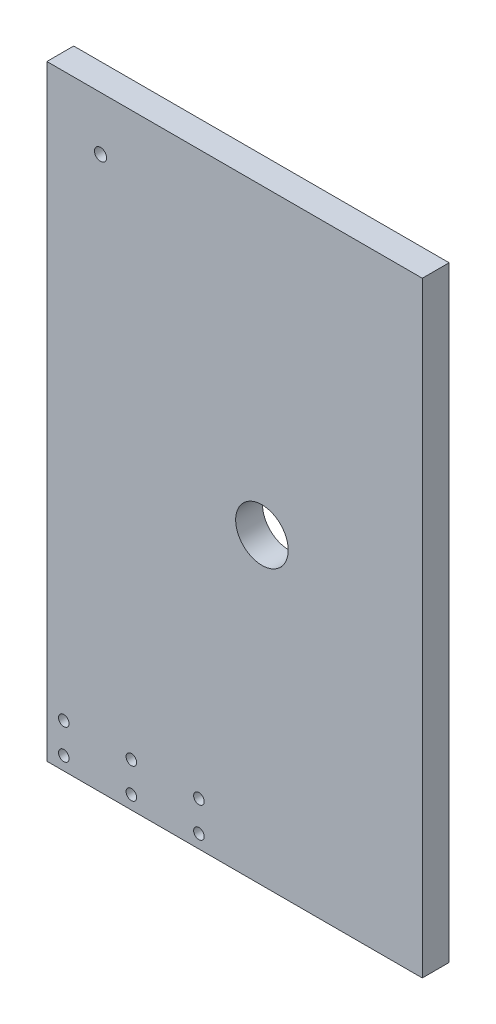
from build123d import *

# Parameters (mm, degrees)
SKETCH1_W           = 152.4
SKETCH1_H           = 143.51
SKETCH1_R           = 6.223
SKETCH1_R_2         = 1.4375
BOSS_EXTRUDE1_DEPTH = 6.35
SKETCH2_R           = 3.1115
CUT_EXTRUDE1_DEPTH  = 105.859632486
SKETCH4_R           = 1.625
CUT_EXTRUDE2_DEPTH  = 105.859632486
SKETCH5_W           = 63.5
SKETCH5_H           = 143.51
CUT_EXTRUDE3_DEPTH  = 105.859632486
SKETCH6_R           = 1.25
CUT_EXTRUDE4_DEPTH  = 105.859632486


with BuildPart() as part:
    # Sketch1 → Boss-Extrude1 (new body)
    with BuildSketch(Plane.XY):
        Rectangle(SKETCH1_W, SKETCH1_H)
        with Locations((-25.272725174, 0.100300785)):
            Circle(SKETCH1_R, mode=Mode.SUBTRACT)
        with Locations((-63.5, 59.055)):
            Circle(SKETCH1_R_2, mode=Mode.SUBTRACT)
    extrude(amount=BOSS_EXTRUDE1_DEPTH)

    # Sketch2 → Cut-Extrude1 (cut, through all)
    with BuildSketch(Plane.XY.offset(6.35)):
        with Locations((63.5, 11.600300785)):
            Circle(SKETCH2_R)
    extrude(amount=-CUT_EXTRUDE1_DEPTH, mode=Mode.SUBTRACT)

    # Sketch4 → Cut-Extrude2 (cut, through all)
    with BuildSketch(Plane.XY.offset(6.35)):
        with Locations((43.849064669, -5.274915009)):
            Circle(SKETCH4_R)
        with Locations((43.849064669, -21.274915009)):
            Circle(SKETCH4_R)
        with Locations((43.849064669, -37.274915009)):
            Circle(SKETCH4_R)
        with Locations((43.849064669, 10.725084991)):
            Circle(SKETCH4_R)
    extrude(amount=-CUT_EXTRUDE2_DEPTH, mode=Mode.SUBTRACT)

    # Sketch5 → Cut-Extrude3 (cut, through all)
    with BuildSketch(Plane(origin=(0, 0, 0), x_dir=(-1, 0, 0), z_dir=(0, 0, -1))):
        with Locations((-44.45, 0)):
            Rectangle(SKETCH5_W, SKETCH5_H)
    extrude(amount=-CUT_EXTRUDE3_DEPTH, mode=Mode.SUBTRACT)

    # Sketch6 → Cut-Extrude4 (cut, through all)
    with BuildSketch(Plane(origin=(0, 0, 0), x_dir=(-1, 0, 0), z_dir=(0, 0, -1))):
        with Locations((72.2, -61.404999872)):
            Circle(SKETCH6_R)
        with Locations((56.2, -61.404999872)):
            Circle(SKETCH6_R)
        with Locations((40.2, -61.404999872)):
            Circle(SKETCH6_R)
        with Locations((72.2, -68.58)):
            Circle(SKETCH6_R)
        with Locations((56.2, -68.58)):
            Circle(SKETCH6_R)
        with Locations((40.2, -68.58)):
            Circle(SKETCH6_R)
    extrude(amount=-CUT_EXTRUDE4_DEPTH, mode=Mode.SUBTRACT)


solid = part.part
